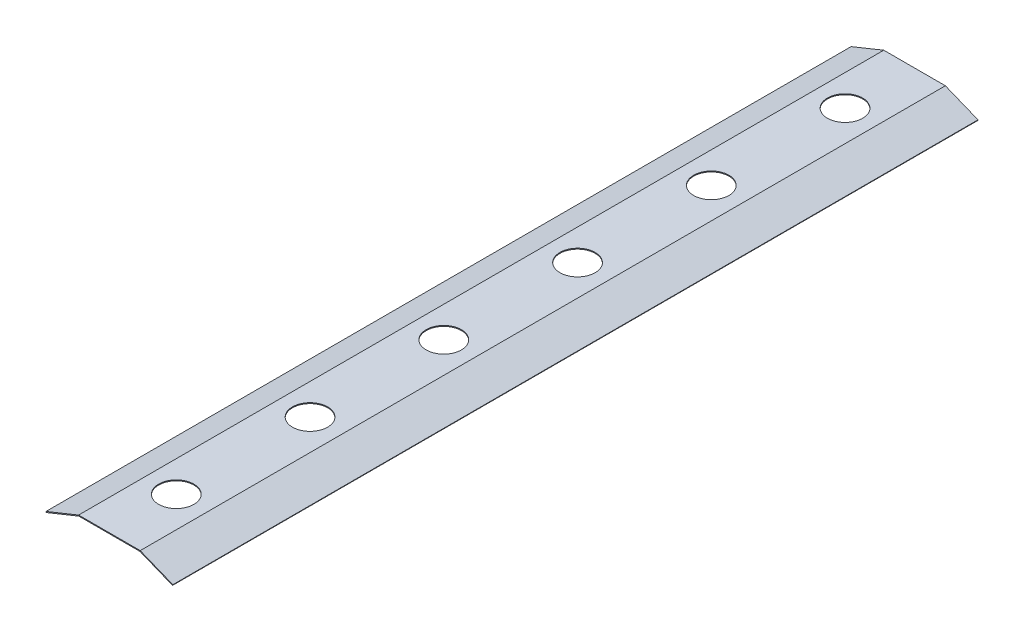
from build123d import *

# Parameters (mm, degrees)
BOSS_EXTRUDE1_DEPTH = 915
SKETCH2_R           = 20
CUT_EXTRUDE1_DEPTH  = 1000


with BuildPart() as part:
    # Sketch1 → Boss-Extrude1 (new body)
    with BuildSketch(Plane.XY):
        Polygon((-35, 0), (35, 0), (72.087354183, -14.984263737), (71.712747589, -15.911447591), (34.805619691, -1), (-34.805619691, -1), (-71.712747589, -15.911447591), (-72.087354183, -14.984263737), align=None)
    extrude(amount=-BOSS_EXTRUDE1_DEPTH)

    # Sketch2 → Cut-Extrude1 (cut)
    with BuildSketch(Plane(origin=(0, 0, 0), x_dir=(1, 0, 0), z_dir=(0, 1, 0))):
        with Locations(Location((0, 76, 0), (0, 0, 180))):
            Circle(SKETCH2_R)
        with Locations(Location((0, 228, 0), (0, 0, 180))):
            Circle(SKETCH2_R)
        with Locations(Location((0, 380, 0), (0, 0, 180))):
            Circle(SKETCH2_R)
        with Locations(Location((0, 532, 0), (0, 0, 180))):
            Circle(SKETCH2_R)
        with Locations(Location((0, 684, 0), (0, 0, 180))):
            Circle(SKETCH2_R)
        with Locations(Location((0, 836, 0), (0, 0, 180))):
            Circle(SKETCH2_R)
    extrude(amount=-CUT_EXTRUDE1_DEPTH, mode=Mode.SUBTRACT)


solid = part.part
